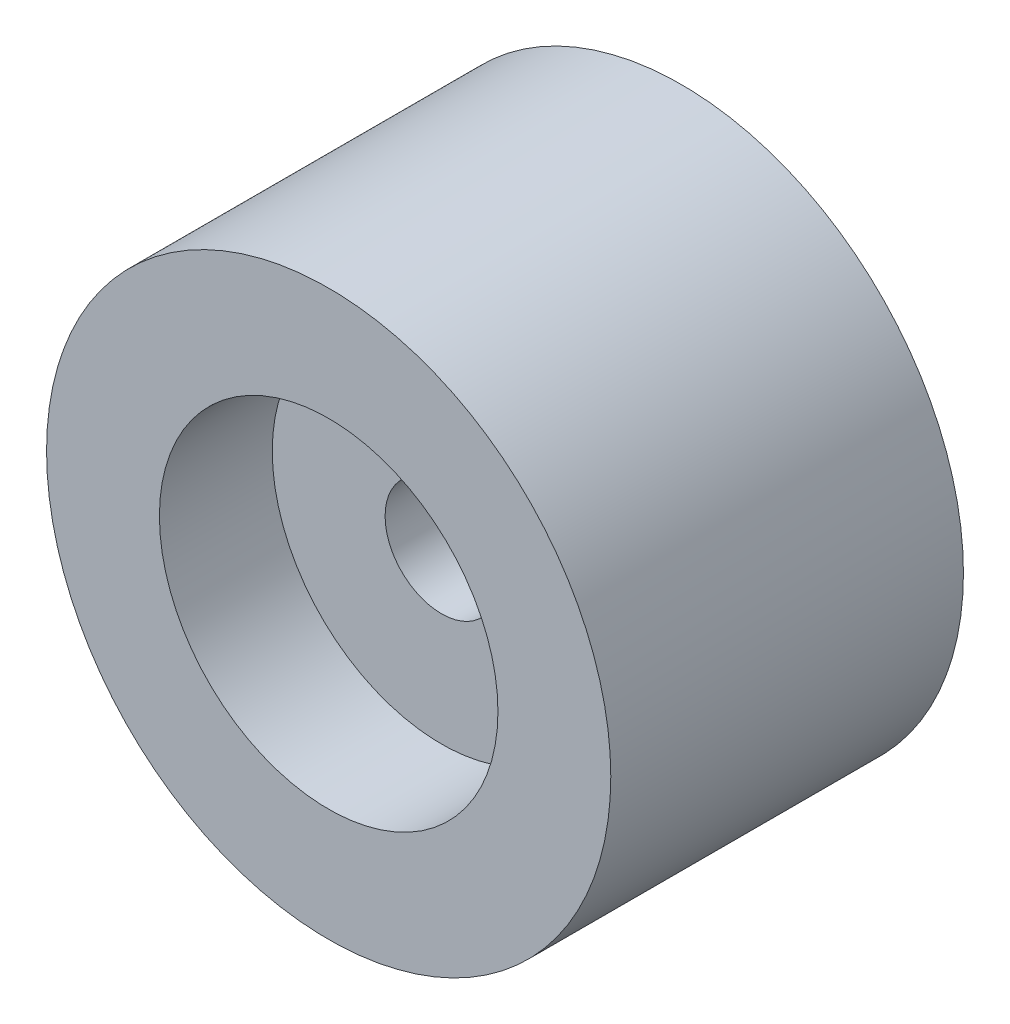
from build123d import *

# Parameters (mm, degrees)
SKETCH_1_R          = 20
SKETCH_1_R_2        = 4
EXTRUDE_1_DEPTH     = 25
SKETCH_2_R          = 12
CUT_EXTRUDE_1_DEPTH = 8
CUT_EXTRUDE_START   = -8
SKETCH_3_R          = 12
CUT_EXTRUDE_2_DEPTH = 8


with BuildPart() as part:
    # 草图1 → 凸台-拉伸1 (new body)
    with BuildSketch(Plane.XY):
        with Locations((-43.920622876, 23.400003441)):
            Circle(SKETCH_1_R)
        with Locations((-43.920622876, 23.400003441)):
            Circle(SKETCH_1_R_2, mode=Mode.SUBTRACT)
    extrude(amount=EXTRUDE_1_DEPTH)

    # 草图2 → 切除-拉伸1 (cut)
    with BuildSketch(Plane.XY.offset(25)):
        with Locations((-43.920622876, 23.400003441)):
            Circle(SKETCH_2_R)
    extrude(amount=-CUT_EXTRUDE_1_DEPTH, mode=Mode.SUBTRACT)

    # 草图3 → 切除-拉伸2 (cut)
    with BuildSketch(Plane(origin=(0, 0, 0), x_dir=(-1, 0, 0), z_dir=(0, 0, -1)).offset(CUT_EXTRUDE_START)):
        with Locations(Location((43.920622876, 23.400003441, 0), (0, 0, 180))):
            Circle(SKETCH_3_R)
    extrude(amount=CUT_EXTRUDE_2_DEPTH, mode=Mode.SUBTRACT)


solid = part.part
